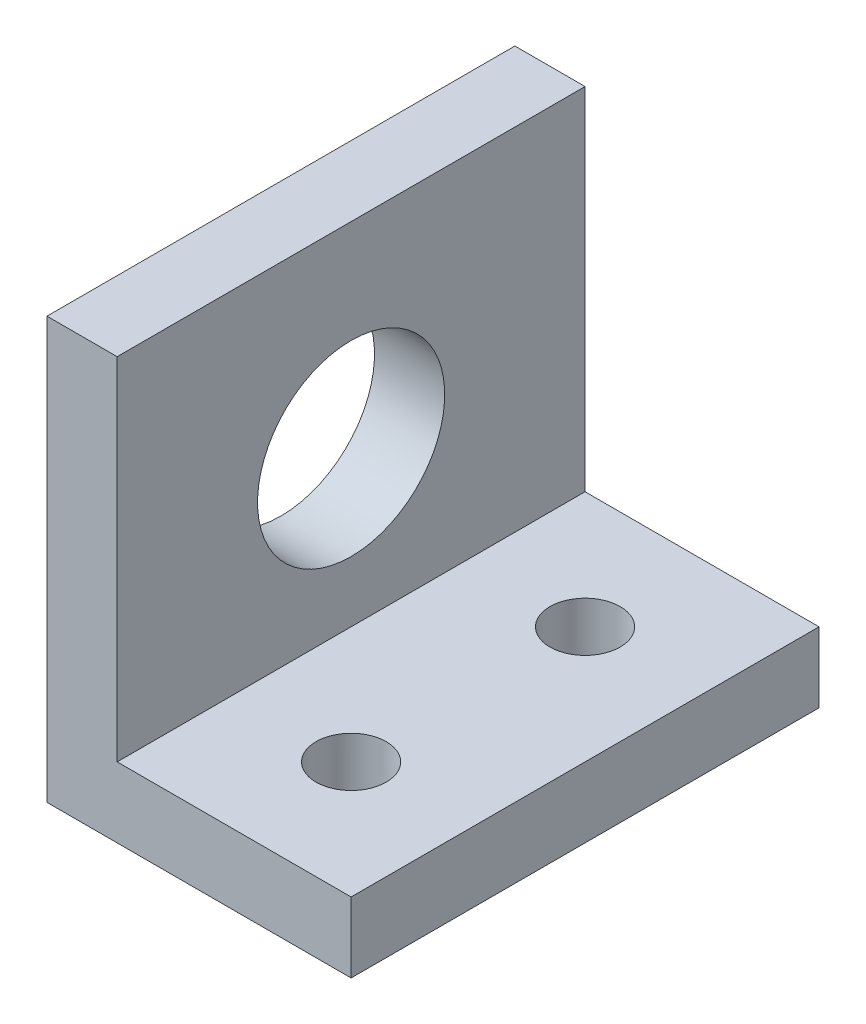
from build123d import *

# Parameters (mm, degrees)
BOSS_EXTRU_1_DEPTH           = 20
ENL_V_MAT_EXTRU_1_DEPTH      = 29.705400189
ENL_V_MAT_EXTRU_1_DEPTH_BACK = 29.705400189
ESQUISSE2_R                  = 4
ENL_V_MAT_EXTRU_2_DEPTH      = 29.178005607
ENL_V_MAT_EXTRU_2_DEPTH_BACK = 29.178005607
ESQUISSE3_R                  = 1.5


with BuildPart() as part:
    # Esquisse1 → Boss.-Extru.1 (new body)
    with BuildSketch(Plane.XY):
        Polygon((0, 0), (13, 0), (13, 3), (3, 3), (3, 18), (0, 18), align=None)
    extrude(amount=BOSS_EXTRU_1_DEPTH)

    # Esquisse2 → Enlèv. mat.-Extru.1 (cut, two sides: drawn at the far end of the back side and taken through both)
    with BuildSketch(Plane(origin=(3, 0, 0), x_dir=(0, 0, -1), z_dir=(1, 0, 0)).offset(-ENL_V_MAT_EXTRU_1_DEPTH_BACK)):
        with Locations((-10, 9.6)):
            Circle(ESQUISSE2_R)
    extrude(amount=ENL_V_MAT_EXTRU_1_DEPTH + ENL_V_MAT_EXTRU_1_DEPTH_BACK, mode=Mode.SUBTRACT)

    # Esquisse3 → Enlèv. mat.-Extru.2 (cut, two sides: drawn at the far end of the back side and taken through both)
    with BuildSketch(Plane(origin=(0, 3, 0), x_dir=(1, 0, 0), z_dir=(0, 1, 0)).offset(-ENL_V_MAT_EXTRU_2_DEPTH_BACK)):
        with Locations((8, -5)):
            Circle(ESQUISSE3_R)
        with Locations((8, -15)):
            Circle(ESQUISSE3_R)
    extrude(amount=ENL_V_MAT_EXTRU_2_DEPTH + ENL_V_MAT_EXTRU_2_DEPTH_BACK, mode=Mode.SUBTRACT)


solid = part.part
